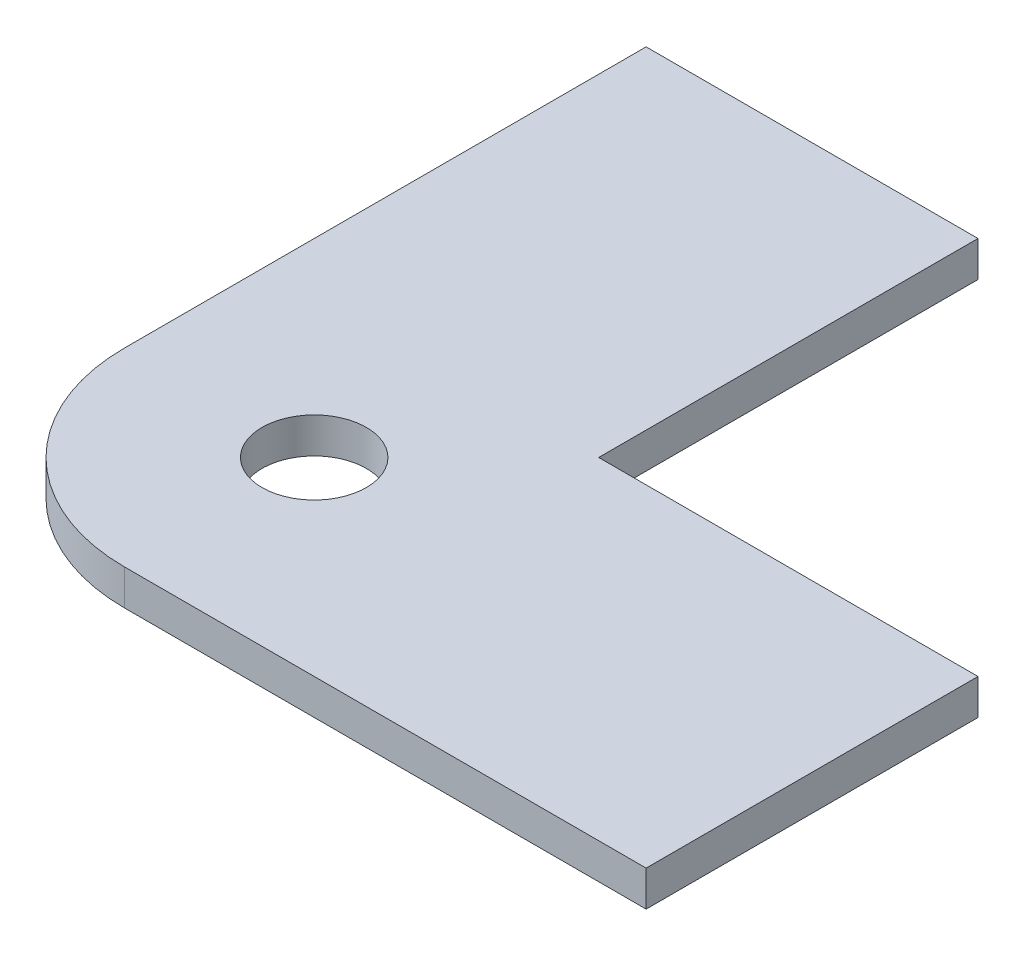
from build123d import *

# Parameters (mm, degrees)
SKETCH1_R           = 1.1
BOSS_EXTRUDE1_DEPTH = 0.75


with BuildPart() as part:
    # Sketch1 → Boss-Extrude1 (new body)
    with BuildSketch(Plane(origin=(0, 0, 0), x_dir=(1, 0, 0), z_dir=(0, 1, 0))):
        with BuildLine():
            Line((11, -3.99967418), (11, 3))
            Line((11, 3), (3, 3))
            Line((3, 3), (3, 11))
            Line((3, 11), (-3.99967418, 11))
            Line((-3.99967418, 11), (-3.99967418, 0))
            ThreePointArc((-3.99967418, 0), (-2.828196736, -2.828196736), (0, -3.99967418))
            Line((0, -3.99967418), (11, -3.99967418))
        make_face()
        with Locations(Location((0, 0, 0), (0, 0, 270))):
            Circle(SKETCH1_R, mode=Mode.SUBTRACT)
    extrude(amount=BOSS_EXTRUDE1_DEPTH)


solid = part.part
